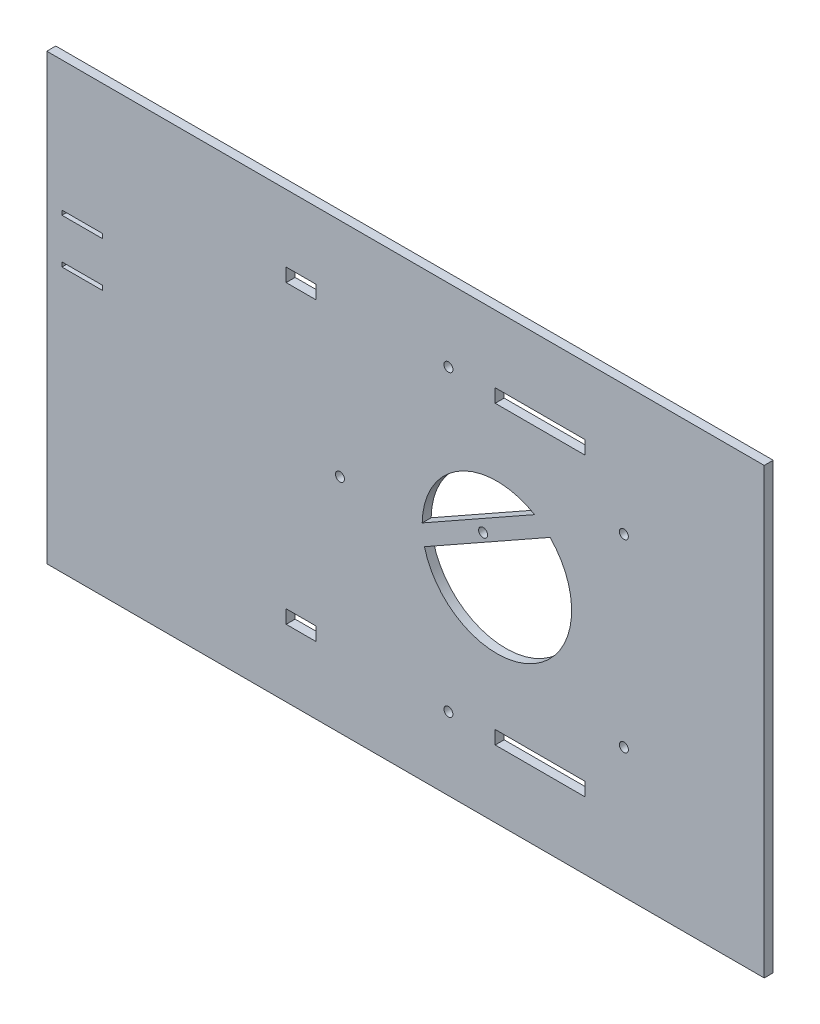
from build123d import *

# Parameters (mm, degrees)
SKETCH1_W           = 240.000854432
SKETCH1_H           = 148.499462854
SKETCH1_R           = 25
SKETCH1_W_2         = 13.501501462
SKETCH1_H_2         = 1.500166829
SKETCH1_H_3         = 1.501200358
SKETCH1_W_3         = 9.930659991
SKETCH1_H_4         = 4.500500488
SKETCH1_W_4         = 29.999719231
SKETCH1_H_5         = 4.500500487
SKETCH1_W_5         = 30.000235995
BOSS_EXTRUDE2_DEPTH = 3
SKETCH2_R           = 1.5
BOSS_EXTRUDE3_DEPTH = 3
SKETCH3_R           = 1.5
CUT_EXTRUDE1_DEPTH  = 3
SKETCH3_3_R         = 1.5
CUT_EXTRUDE2_DEPTH  = 3


with BuildPart() as part:
    # Sketch1 → Boss-Extrude2 (new body)
    with BuildSketch(Plane.XY):
        Rectangle(SKETCH1_W, SKETCH1_H)
        with Locations((30.570227043, 0.001291911)):
            Circle(SKETCH1_R, mode=Mode.SUBTRACT)
        with Locations((-108.180218479, 30.002561435)):
            Rectangle(SKETCH1_W_2, SKETCH1_H_2, mode=Mode.SUBTRACT)
        with Locations((-108.180218479, 15.00037638)):
            Rectangle(SKETCH1_W_2, SKETCH1_H_3, mode=Mode.SUBTRACT)
        with Locations((-34.96659952, 49.499562569)):
            Rectangle(SKETCH1_W_3, SKETCH1_H_4, mode=Mode.SUBTRACT)
        with Locations((44.998545318, 49.499562569)):
            Rectangle(SKETCH1_W_4, SKETCH1_H_4, mode=Mode.SUBTRACT)
        with Locations((-34.96659952, -49.498529041)):
            Rectangle(SKETCH1_W_3, SKETCH1_H_5, mode=Mode.SUBTRACT)
        with Locations((45.000353993, -49.498529041)):
            Rectangle(SKETCH1_W_5, SKETCH1_H_5, mode=Mode.SUBTRACT)
    extrude(amount=BOSS_EXTRUDE2_DEPTH)

    # Sketch2 → Boss-Extrude3 (add)
    # profile 1 of 2: a face of its own
    with BuildSketch(Plane.XY.offset(3)):
        with Locations((45.531251612, -26.95033278)):
            Circle(SKETCH2_R)
    # profile 2 of 2: a face of its own
    with BuildSketch(Plane.XY.offset(3)):
        Polygon((27.163645512, 5.615664927), (48.357135802, 17.569042957), (45.390356123, 22.829180815), (3.83834926, -0.606640239), (6.127103067, -6.249192671), align=None)
        with Locations((25.948903296, 7.769418226)):
            Circle(SKETCH2_R, mode=Mode.SUBTRACT)
    extrude(amount=-BOSS_EXTRUDE3_DEPTH)

    # Sketch3 → Cut-Extrude1 (cut)
    with BuildSketch(Plane.XY.offset(3)):
        with Locations((-21.929772957, 0.001291911)):
            Circle(SKETCH3_R)
    extrude(amount=-CUT_EXTRUDE1_DEPTH, mode=Mode.SUBTRACT)

    # Sketch3<3> → Cut-Extrude2 (cut)
    with BuildSketch(Plane.XY.offset(3)):
        with Locations((-21.929772957, 0.001291911)):
            Circle(SKETCH3_3_R)
        with Locations((14.346834838, 49.931759016)):
            Circle(SKETCH3_3_R)
        with Locations((73.043619248, 30.860017656)):
            Circle(SKETCH3_3_R)
        with Locations((73.043619248, -30.857433835)):
            Circle(SKETCH3_3_R)
        with Locations((14.346834838, -49.929175195)):
            Circle(SKETCH3_3_R)
    extrude(amount=-CUT_EXTRUDE2_DEPTH, mode=Mode.SUBTRACT)


solid = part.part
